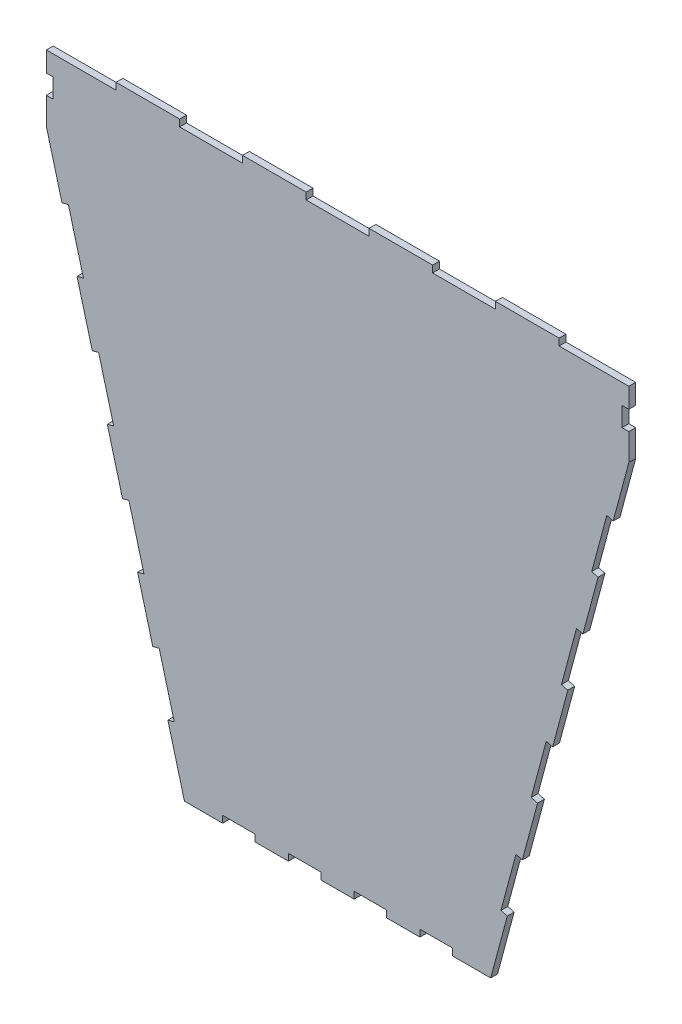
from build123d import *

# Parameters (mm, degrees)
BOSS_EXTRUDE1_DEPTH = 3
SKETCH2_W           = 249.6
SKETCH2_H           = 3
SKETCH2_W_2         = 14.577777778
SKETCH2_W_3         = 14.577777777
BOSS_EXTRUDE2_DEPTH = 3
BOSS_EXTRUDE5_DEPTH = 3
BOSS_EXTRUDE4_DEPTH = 3


with BuildPart() as part:
    # Sketch1 → Boss-Extrude1 (new body)
    with BuildSketch(Plane.XY):
        Polygon((-124.8, 111.588319146), (124.8, 111.588319146), (65, -111.588319146), (-65, -111.588319146), align=None)
    extrude(amount=BOSS_EXTRUDE1_DEPTH)

    # Sketch2 → Boss-Extrude2 (add, through all)
    with BuildSketch(Plane.XY.offset(3)):
        with Locations((0, 113.088319146)):
            Rectangle(SKETCH2_W, SKETCH2_H)
        with Locations((-57.711111111, -113.088319146)):
            Rectangle(SKETCH2_W_2, SKETCH2_H)
        with Locations((-28.855555556, -113.088319146)):
            Rectangle(SKETCH2_W_3, SKETCH2_H)
        with Locations((0, -113.088319146)):
            Rectangle(SKETCH2_W_2, SKETCH2_H)
        with Locations((28.855555556, -113.088319146)):
            Rectangle(SKETCH2_W_3, SKETCH2_H)
        with Locations((57.711111111, -113.088319146)):
            Rectangle(SKETCH2_W_2, SKETCH2_H)
    extrude(amount=-BOSS_EXTRUDE2_DEPTH)

    # Sketch4 → Boss-Extrude5 (add, through all)
    with BuildSketch(Plane.XY.offset(3)):
        Polygon((-124.8, 140.588319146), (-97.2, 140.588319146), (-97.2, 143.588319146), (-69.3, 143.588319146), (-69.3, 140.588319146), (-41.7, 140.588319146), (-41.7, 143.588319146), (-13.8, 143.588319146), (-13.8, 140.588319146), (13.8, 140.588319146), (13.8, 143.588319146), (41.7, 143.588319146), (41.7, 140.588319146), (69.3, 140.588319146), (69.3, 143.588319146), (97.2, 143.588319146), (97.2, 140.588319146), (124.8, 140.588319146), (127.8, 140.588319146), (127.8, 131.82165248), (124.8, 131.82165248), (124.8, 123.354985813), (127.8, 123.354985813), (127.8, 114.588319146), (124.8, 114.588319146), (-124.8, 114.588319146), (-127.8, 114.588319146), (-127.8, 123.354985813), (-124.8, 123.354985813), (-124.8, 131.82165248), (-127.8, 131.82165248), (-127.8, 140.588319146), align=None)
    extrude(amount=-BOSS_EXTRUDE5_DEPTH)

    # Sketch3 → Boss-Extrude4 (add, through all)
    with BuildSketch(Plane.XY.offset(3)):
        Polygon((127.8, 114.588319146), (124.8, 114.588319146), (124.8, 111.588319146), (118.12104635, 86.662124781), (120.920084455, 85.912124781), (127.8, 111.588319146), align=None)
        Polygon((74.477991756, -87.412124781), (71.67895365, -86.662124781), (65, -111.588319146), (65, -114.588319146), (67.196152423, -114.588319146), align=None)
        Polygon((87.758253344, -37.849513799), (84.959215238, -37.099513799), (78.280261587, -62.025708164), (81.079299693, -62.775708164), align=None)
        Polygon((101.038514931, 11.713097182), (98.239476825, 12.463097182), (91.560523175, -12.463097182), (94.35956128, -13.213097182), align=None)
        Polygon((114.318776518, 61.275708164), (111.519738413, 62.025708164), (104.840784762, 37.099513799), (107.639822868, 36.349513799), align=None)
        Polygon((-65, -111.588319146), (-71.67895365, -86.662124781), (-74.477991756, -87.412124781), (-67.196152423, -114.588319146), (-65, -114.588319146), align=None)
        Polygon((-78.280261587, -62.025708164), (-84.959215238, -37.099513799), (-87.758253344, -37.849513799), (-81.079299693, -62.775708164), align=None)
        Polygon((-91.560523175, -12.463097182), (-98.239476825, 12.463097182), (-101.038514931, 11.713097182), (-94.35956128, -13.213097182), align=None)
        Polygon((-104.840784762, 37.099513799), (-111.519738413, 62.025708164), (-114.318776518, 61.275708164), (-107.639822868, 36.349513799), align=None)
        Polygon((-127.8, 111.588319146), (-120.920084455, 85.912124781), (-118.12104635, 86.662124781), (-124.8, 111.588319146), (-124.8, 114.588319146), (-127.8, 114.588319146), align=None)
    extrude(amount=-BOSS_EXTRUDE4_DEPTH)


solid = part.part
